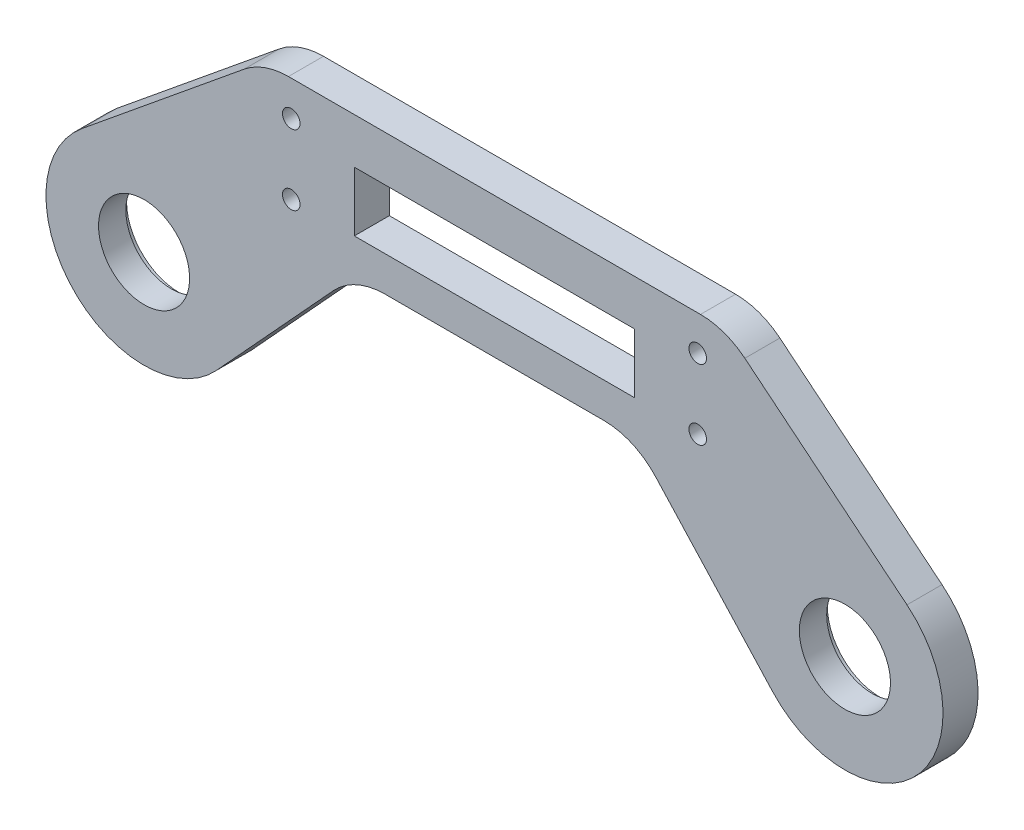
from build123d import *

# Parameters (mm, degrees)
EXTRUDE_1_DEPTH     = 5
SKETCH_4_W          = 40
SKETCH_4_H          = 8.5
CUT_EXTRUDE_1_DEPTH = 5
SKETCH_5_R          = 1.25
CUT_EXTRUDE_2_DEPTH = 7
SKETCH_9_R          = 6.5
CUT_EXTRUDE_4_DEPTH = 5
SKETCH_10_R         = 7.5
CUT_EXTRUDE_5_DEPTH = 1.1


with BuildPart() as part:
    # 草图3 → 凸台-拉伸1 (new body)
    with BuildSketch(Plane.XY):
        with BuildLine():
            Line((-35.723215038, 7.743839121), (-58.858024221, -11.158625231))
            ThreePointArc((-58.858024221, -11.158625231), (-60.178030432, -31.612892204), (-39.681768347, -31.462245799))
            Line((-39.681768347, -31.462245799), (-22.972363252, -13.241253001))
            ThreePointArc((-22.972363252, -13.241253001), (-19.627898346, -10.846108205), (-15.602197786, -10))
            Line((-15.602197786, -10), (15.602197786, -10))
            ThreePointArc((15.602197786, -10), (19.627898346, -10.846108205), (22.972363252, -13.241253001))
            Line((22.972363252, -13.241253001), (39.681768347, -31.462245799))
            ThreePointArc((39.681768347, -31.462245799), (60.178030432, -31.612892204), (58.858024221, -11.158625231))
            Line((58.858024221, -11.158625231), (35.723215038, 7.743839121))
            ThreePointArc((35.723215038, 7.743839121), (32.754745755, 9.419086771), (29.39605488, 10))
            Line((29.39605488, 10), (-29.39605488, 10))
            ThreePointArc((-29.39605488, 10), (-32.754745755, 9.419086771), (-35.723215038, 7.743839121))
        make_face()
    extrude(amount=EXTRUDE_1_DEPTH)

    # 草图4 → 切除-拉伸1 (cut)
    with BuildSketch(Plane.XY.offset(5)):
        with Locations((0, -0.75)):
            Rectangle(SKETCH_4_W, SKETCH_4_H)
    extrude(amount=-CUT_EXTRUDE_1_DEPTH, mode=Mode.SUBTRACT)

    # 草图5 → 切除-拉伸2 (cut)
    with BuildSketch(Plane.XY.offset(5)):
        with Locations((-29, -5)):
            Circle(SKETCH_5_R)
        with Locations((-29, 5)):
            Circle(SKETCH_5_R)
    cut_extrude_2 = extrude(amount=-CUT_EXTRUDE_2_DEPTH, mode=Mode.SUBTRACT)

    # 草图9 → 切除-拉伸4 (cut)
    with BuildSketch(Plane(origin=(0, 0, 0), x_dir=(-1, 0, 0), z_dir=(0, 0, -1))):
        with Locations((-50, -22)):
            Circle(SKETCH_9_R)
        with Locations((50, -22)):
            Circle(SKETCH_9_R)
    extrude(amount=-CUT_EXTRUDE_4_DEPTH, mode=Mode.SUBTRACT)

    # 草图10 → 切除-拉伸5 (cut)
    with BuildSketch(Plane(origin=(0, 0, 0), x_dir=(-1, 0, 0), z_dir=(0, 0, -1))):
        with Locations((-50, -22)):
            Circle(SKETCH_10_R)
        with Locations((50, -22)):
            Circle(SKETCH_10_R)
    extrude(amount=-CUT_EXTRUDE_5_DEPTH, mode=Mode.SUBTRACT)

    # 镜向1: 切除-拉伸2 across plane
    add(cut_extrude_2.mirror(Plane.ZY), mode=Mode.SUBTRACT)


solid = part.part
